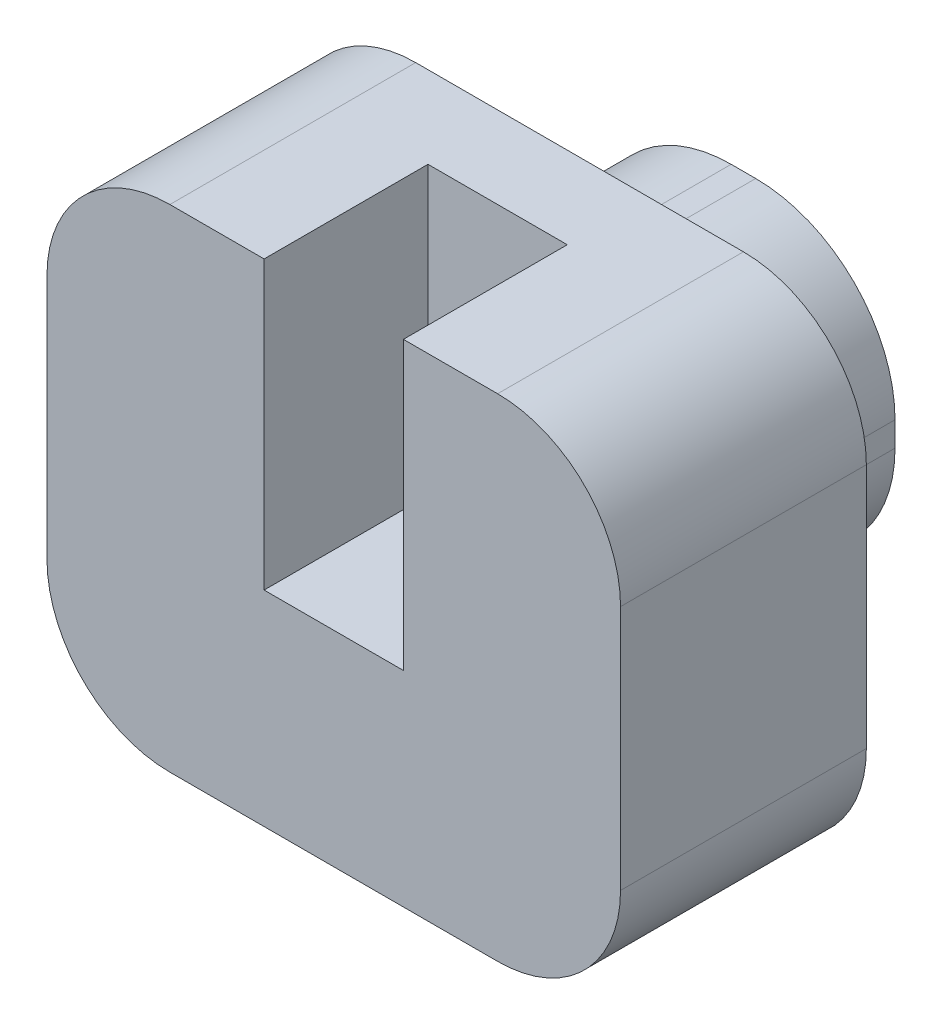
from build123d import *

# Parameters (mm, degrees)
EXTRUDE_1_DEPTH     = 2
EXTRUDE_2_DEPTH     = 3
SKETCH_4_W          = 1.7
SKETCH_4_H          = 2
CUT_EXTRUDE_1_DEPTH = 3.5


with BuildPart() as part:
    # Эскиз1 → Бобышка-Вытянуть1 (new body)
    with BuildSketch(Plane.XY):
        with BuildLine():
            Line((-0.15, -1.85), (0.15, -1.85))
            ThreePointArc((0.15, -1.85), (1.352081528, -1.352081528), (1.85, -0.15))
            Line((1.85, -0.15), (1.85, 0.15))
            ThreePointArc((1.85, 0.15), (1.352081528, 1.352081528), (0.15, 1.85))
            Line((0.15, 1.85), (-0.15, 1.85))
            ThreePointArc((-0.15, 1.85), (-1.352081528, 1.352081528), (-1.85, 0.15))
            Line((-1.85, 0.15), (-1.85, -0.15))
            ThreePointArc((-1.85, -0.15), (-1.352081528, -1.352081528), (-0.15, -1.85))
        make_face()
    extrude(amount=EXTRUDE_1_DEPTH)

    # Эскиз2 → Бобышка-Вытянуть2 (add)
    with BuildSketch(Plane.XY.offset(2)):
        with BuildLine():
            Line((-2, -3), (2, -3))
            ThreePointArc((2, -3), (3.060660172, -2.560660172), (3.5, -1.5))
            Line((3.5, -1.5), (3.5, 1.5))
            ThreePointArc((3.5, 1.5), (3.060660172, 2.560660172), (2, 3))
            Line((2, 3), (-2, 3))
            ThreePointArc((-2, 3), (-3.060660172, 2.560660172), (-3.5, 1.5))
            Line((-3.5, 1.5), (-3.5, -1.5))
            ThreePointArc((-3.5, -1.5), (-3.060660172, -2.560660172), (-2, -3))
        make_face()
    extrude(amount=EXTRUDE_2_DEPTH)

    # Эскиз4 → Вырез-Вытянуть1 (cut)
    with BuildSketch(Plane(origin=(0, 3, 0), x_dir=(1, 0, 0), z_dir=(0, 1, 0))):
        with Locations((0, -4)):
            Rectangle(SKETCH_4_W, SKETCH_4_H)
    extrude(amount=-CUT_EXTRUDE_1_DEPTH, mode=Mode.SUBTRACT)


solid = part.part
